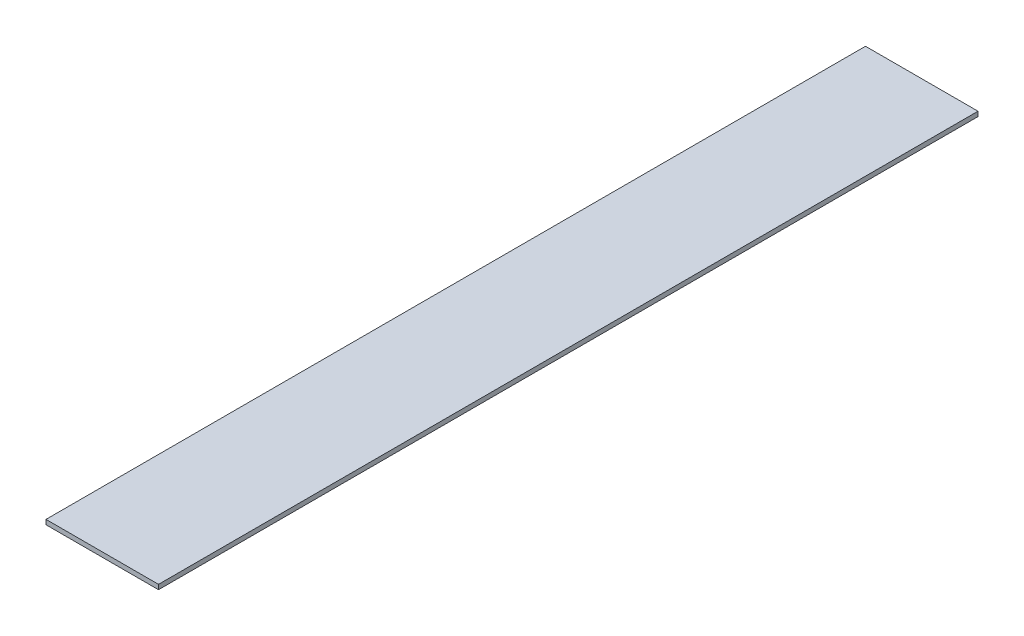
from build123d import *

# Parameters (mm, degrees)
SKETCH1_W               = 930
SKETCH1_H               = 555
SKETCH1_W_2             = 777.6
SKETCH1_H_2             = 478.8
BOSS_EXTRUDE2_DEPTH     = 3.175
CUT_EXTRUDE1_DEPTH      = 542.517618019
CUT_EXTRUDE1_DEPTH_BACK = 542.517618019
SKETCH2_W               = 853.8
SKETCH2_H               = 555


with BuildPart() as part:
    # Sketch1 → Boss-Extrude2 (new body)
    with BuildSketch(Plane(origin=(0, 0, 0), x_dir=(1, 0, 0), z_dir=(0, 1, 0))):
        Rectangle(SKETCH1_W, SKETCH1_H)
        Rectangle(SKETCH1_W_2, SKETCH1_H_2, mode=Mode.SUBTRACT)
    extrude(amount=BOSS_EXTRUDE2_DEPTH)

    # Sketch2 → Cut-Extrude1 (cut, two sides: drawn at the far end of the back side and taken through both)
    with BuildSketch(Plane(origin=(0, 3.175, 0), x_dir=(1, 0, 0), z_dir=(0, 1, 0)).offset(-CUT_EXTRUDE1_DEPTH_BACK)):
        with Locations((38.1, 0)):
            Rectangle(SKETCH2_W, SKETCH2_H)
    extrude(amount=CUT_EXTRUDE1_DEPTH + CUT_EXTRUDE1_DEPTH_BACK, mode=Mode.SUBTRACT)


solid = part.part
